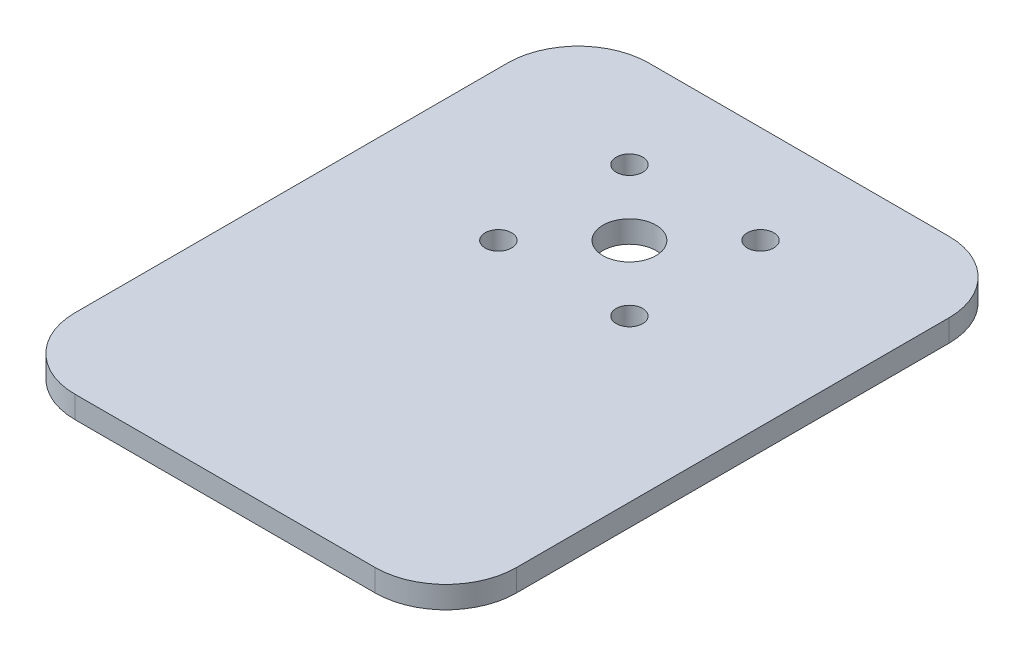
from build123d import *

# Parameters (mm, degrees)
SKETCH_1_R      = 1.5
SKETCH_1_R_2    = 3
EXTRUDE_1_DEPTH = 2.5


with BuildPart() as part:
    # 草图1 → 凸台-拉伸1 (new body)
    with BuildSketch(Plane(origin=(0, 0, 0), x_dir=(1, 0, 0), z_dir=(0, 1, 0))):
        with BuildLine():
            Line((-17, -32.5), (17, -32.5))
            ThreePointArc((17, -32.5), (22.656854249, -30.156854249), (25, -24.5))
            Line((25, -24.5), (25, 24.5))
            ThreePointArc((25, 24.5), (22.656854249, 30.156854249), (17, 32.5))
            Line((17, 32.5), (-17, 32.5))
            ThreePointArc((-17, 32.5), (-22.656854249, 30.156854249), (-25, 24.5))
            Line((-25, 24.5), (-25, -24.5))
            ThreePointArc((-25, -24.5), (-22.656854249, -30.156854249), (-17, -32.5))
        make_face()
        with Locations(Location((6.73017257, 21.424621202, 0), (0, 0, 270))):
            Circle(SKETCH_1_R, mode=Mode.SUBTRACT)
        with Locations(Location((-8.119069835, 21.424621202, 0), (0, 0, 270))):
            Circle(SKETCH_1_R, mode=Mode.SUBTRACT)
        with Locations(Location((-8.119069835, 6.575378798, 0), (0, 0, 270))):
            Circle(SKETCH_1_R, mode=Mode.SUBTRACT)
        with Locations(Location((6.73017257, 6.575378798, 0), (0, 0, 270))):
            Circle(SKETCH_1_R, mode=Mode.SUBTRACT)
        with Locations(Location((-0.694448633, 14, 0), (0, 0, 270))):
            Circle(SKETCH_1_R_2, mode=Mode.SUBTRACT)
    extrude(amount=EXTRUDE_1_DEPTH)


solid = part.part
